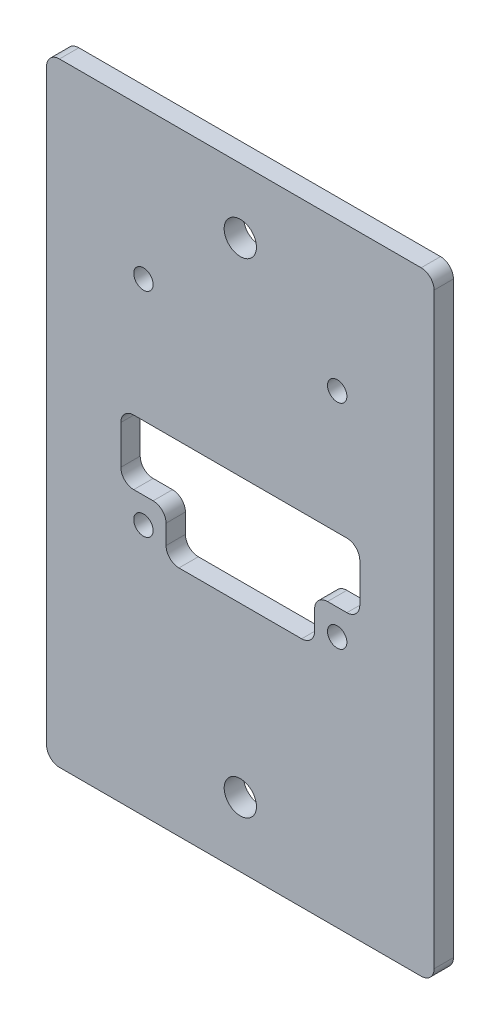
from build123d import *

# Parameters (mm, degrees)
SKETCH1_R           = 2.5
SKETCH1_R_2         = 1.5
BOSS_EXTRUDE1_DEPTH = 3


with BuildPart() as part:
    # Sketch1 → Boss-Extrude1 (new body)
    with BuildSketch(Plane.XY):
        with BuildLine():
            Line((-28, -47.5), (28, -47.5))
            ThreePointArc((28, -47.5), (29.414213562, -46.914213562), (30, -45.5))
            Line((30, -45.5), (30, 45.5))
            ThreePointArc((30, 45.5), (29.414213562, 46.914213562), (28, 47.5))
            Line((28, 47.5), (-28, 47.5))
            ThreePointArc((-28, 47.5), (-29.414213562, 46.914213562), (-30, 45.5))
            Line((-30, 45.5), (-30, -45.5))
            ThreePointArc((-30, -45.5), (-29.414213562, -46.914213562), (-28, -47.5))
        make_face()
        with Locations((0, 37.5)):
            Circle(SKETCH1_R, mode=Mode.SUBTRACT)
        with Locations((0, -37.5)):
            Circle(SKETCH1_R, mode=Mode.SUBTRACT)
        with Locations((-15, 24.5)):
            Circle(SKETCH1_R_2, mode=Mode.SUBTRACT)
        with Locations((15, 24.5)):
            Circle(SKETCH1_R_2, mode=Mode.SUBTRACT)
        with Locations((-15, -8.5)):
            Circle(SKETCH1_R_2, mode=Mode.SUBTRACT)
        with Locations((15, -8.5)):
            Circle(SKETCH1_R_2, mode=Mode.SUBTRACT)
        with BuildLine():
            Line((-11.5, -9.5), (-11.5, -6.5))
            ThreePointArc((-11.5, -6.5), (-12.085786438, -5.085786438), (-13.5, -4.5))
            Line((-13.5, -4.5), (-16.5, -4.5))
            ThreePointArc((-16.5, -4.5), (-17.914213562, -3.914213562), (-18.5, -2.5))
            Line((-18.5, -2.5), (-18.5, 3.5))
            ThreePointArc((-18.5, 3.5), (-17.914213562, 4.914213562), (-16.5, 5.5))
            Line((-16.5, 5.5), (16.5, 5.5))
            ThreePointArc((16.5, 5.5), (17.914213562, 4.914213562), (18.5, 3.5))
            Line((18.5, 3.5), (18.5, -2.5))
            ThreePointArc((18.5, -2.5), (17.914213562, -3.914213562), (16.5, -4.5))
            Line((16.5, -4.5), (13.5, -4.5))
            ThreePointArc((13.5, -4.5), (12.085786438, -5.085786438), (11.5, -6.5))
            Line((11.5, -6.5), (11.5, -9.5))
            ThreePointArc((11.5, -9.5), (10.914213562, -10.914213562), (9.5, -11.5))
            Line((9.5, -11.5), (-9.5, -11.5))
            ThreePointArc((-9.5, -11.5), (-10.914213562, -10.914213562), (-11.5, -9.5))
        make_face(mode=Mode.SUBTRACT)
    extrude(amount=BOSS_EXTRUDE1_DEPTH)


solid = part.part
